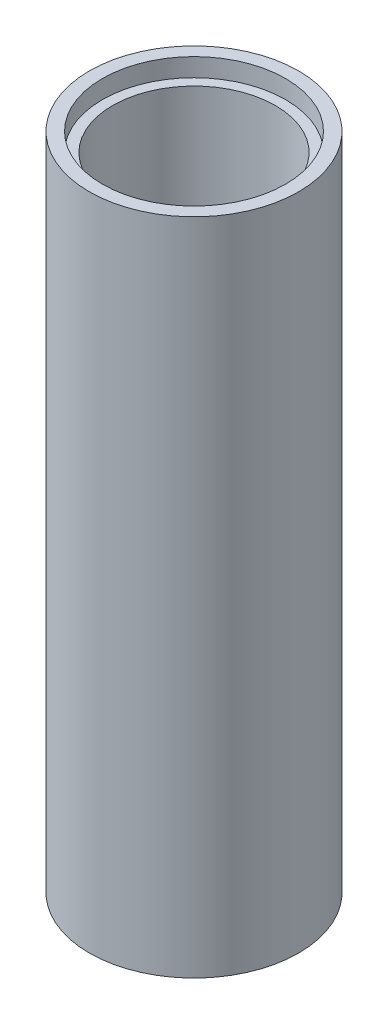
from build123d import *

# Parameters (mm, degrees)
SKETCH1_R           = 57.15
SKETCH1_R_2         = 44.45
BOSS_EXTRUDE1_DEPTH = 360
SKETCH2_R           = 50
CUT_EXTRUDE1_DEPTH  = 10


with BuildPart() as part:
    # Sketch1 → Boss-Extrude1 (new body)
    with BuildSketch(Plane(origin=(0, 0, 0), x_dir=(1, 0, 0), z_dir=(0, 1, 0))):
        with Locations(Location((0, 0, 0), (0, 0, 90))):
            Circle(SKETCH1_R)
        with Locations(Location((0, 0, 0), (0, 0, 90))):
            Circle(SKETCH1_R_2, mode=Mode.SUBTRACT)
    extrude(amount=BOSS_EXTRUDE1_DEPTH)

    # Sketch2 → Cut-Extrude1 (cut)
    with BuildSketch(Plane(origin=(0, 360, 0), x_dir=(1, 0, 0), z_dir=(0, 1, 0))):
        with Locations(Location((0, 0, 0), (0, 0, 270))):
            Circle(SKETCH2_R)
    extrude(amount=-CUT_EXTRUDE1_DEPTH, mode=Mode.SUBTRACT)


solid = part.part
